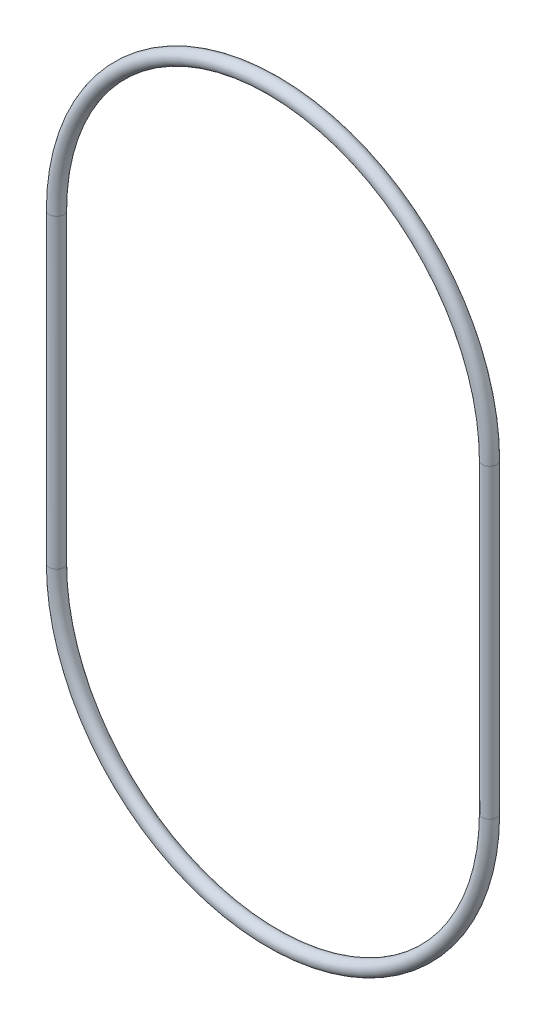
from build123d import *

# Parameters (mm, degrees)
ESQUISSE2_R = 1.125


with BuildPart() as part:
    # Base-Balayage: sweep along a path in Esquisse1
    with BuildLine(Plane.XY) as base_balayage_path:
        Line((-34, 0), (-34, -48))
        ThreePointArc((-34, -48), (0, -82), (34, -48))
        Line((34, -48), (34, 0))
        ThreePointArc((34, 0), (0, 34), (-34, 0))
    # Esquisse2 → Base-Balayage (sweep)
    with BuildSketch(Plane(origin=(0, 0, 0), x_dir=(1, 0, 0), z_dir=(0, 1, 0))):
        with Locations((34, 0)):
            Circle(ESQUISSE2_R)
    sweep(path=base_balayage_path.line)


solid = part.part
